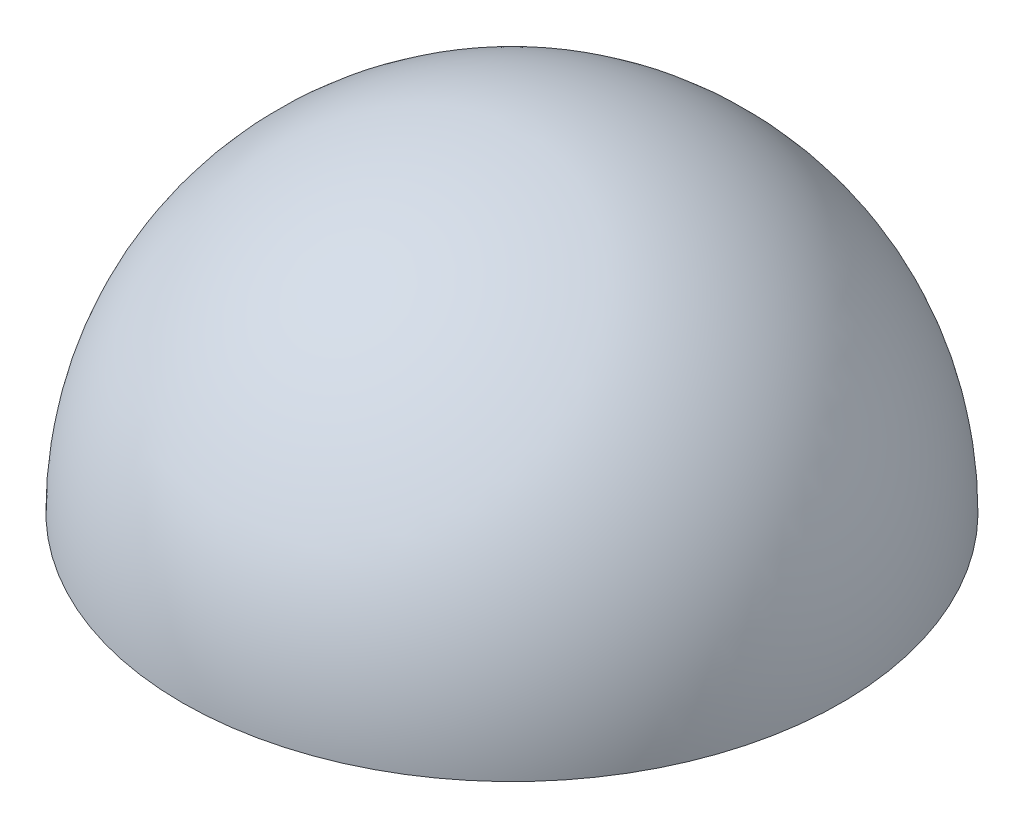
from build123d import *

# Parameters (mm, degrees)
REVOLVE1_ANGLE            = 180
F_6_0MM_DOWEL_HOLE1_D     = 6
F_6_0MM_DOWEL_HOLE1_DEPTH = 4
F_6_0MM_DOWEL_HOLE1_TIP   = 1.802581857


with BuildPart() as part:
    # Sketch1 → Revolve1 (revolve)
    with BuildSketch(Plane(origin=(0, 0, 0), x_dir=(1, 0, 0), z_dir=(0, 1, 0))):
        with BuildLine():
            Line((0, 0), (20, 0))
            ThreePointArc((20, 0), (10, 10), (0, 0))
        make_face()
    revolve(axis=Axis((0, 0, 0), (1, 0, 0)), revolution_arc=REVOLVE1_ANGLE)

    # Ø6.0mm Dowel Hole1
    with Locations(Plane(origin=(0, 0, 0), x_dir=(-1, 0, 0), z_dir=(0, -1, 0))):
        with Locations((-10, 0)):
            Hole(F_6_0MM_DOWEL_HOLE1_D / 2, depth=F_6_0MM_DOWEL_HOLE1_DEPTH)
            with Locations((0, 0, -(F_6_0MM_DOWEL_HOLE1_DEPTH + F_6_0MM_DOWEL_HOLE1_TIP / 2))):  # 118° drill point
                Cone(0, F_6_0MM_DOWEL_HOLE1_D / 2, F_6_0MM_DOWEL_HOLE1_TIP, mode=Mode.SUBTRACT)


solid = part.part
